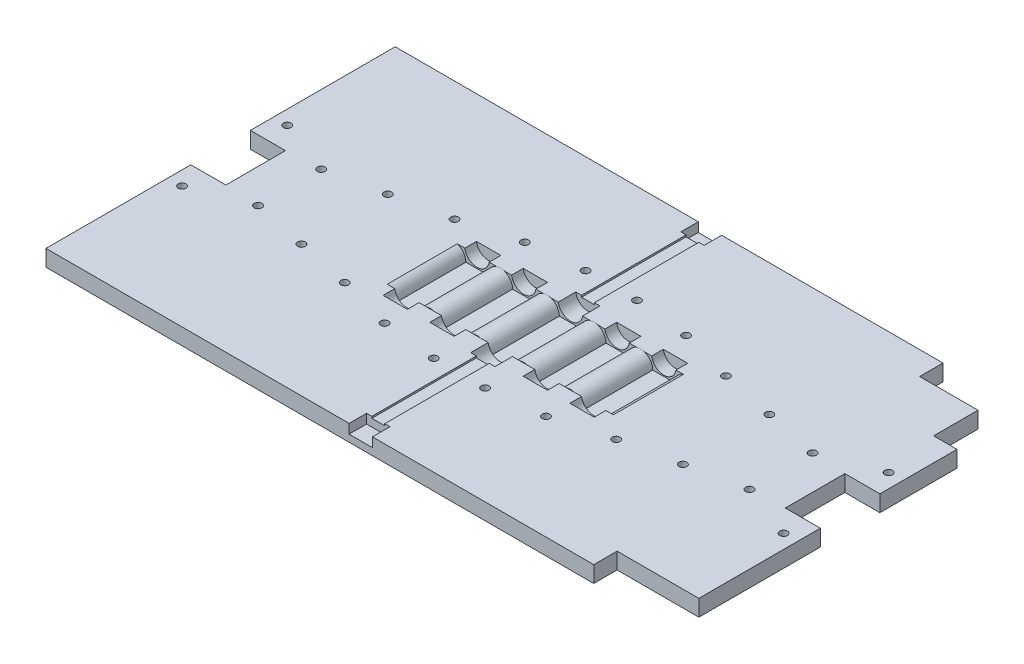
from build123d import *

# Parameters (mm, degrees)
SKETCH1_W               = 539
SKETCH1_H               = 299
BOSS_EXTRUDE1_DEPTH     = 14
SKETCH15_W              = 70
SKETCH15_H              = 20
CUT_EXTRUDE8_DEPTH      = 309.506888092
SKETCH2_W               = 30
SKETCH2_H               = 51
CUT_EXTRUDE1_DEPTH      = 309.506888092
SKETCH16_W              = 200
SKETCH16_H              = 60
CUT_EXTRUDE9_DEPTH      = 10
SKETCH17_R              = 10.5
CUT_EXTRUDE10_DEPTH     = 15
SKETCH18_R              = 10.5
CUT_EXTRUDE11_DEPTH     = 10
BOSS_EXTRUDE2_DEPTH     = 60
MIRROR4_COPY_1_SKETCH_R = 10.5
MIRROR4_COPY_1_DEPTH    = 10
M6_CLEARANCE_HOLE1_D    = 6.6
MIRROR7_COPY_1_D        = 6.6
SKETCH23_W              = 11
SKETCH23_H              = 104.5
CUT_EXTRUDE12_DEPTH     = 1.5
SKETCH24_W              = 20
SKETCH24_H              = 30
CUT_EXTRUDE13_DEPTH     = 8


with BuildPart() as part:
    # Sketch1 → Boss-Extrude1 (new body)
    with BuildSketch(Plane(origin=(0, 0, 0), x_dir=(1, 0, 0), z_dir=(0, 1, 0))):
        Rectangle(SKETCH1_W, SKETCH1_H)
    extrude(amount=-BOSS_EXTRUDE1_DEPTH)

    # Sketch15 → Cut-Extrude8 (cut, through all)
    with BuildSketch(Plane(origin=(0, 0, 0), x_dir=(1, 0, 0), z_dir=(0, 1, 0))):
        Polygon((269.5, 149.5), (199.5, 149.5), (199.5, 129.5), (249.5, 129.5), (249.5, 91.5), (269.5, 91.5), align=None)
        with Locations((234.5, -139.5)):
            Rectangle(SKETCH15_W, SKETCH15_H)
    extrude(amount=-CUT_EXTRUDE8_DEPTH, mode=Mode.SUBTRACT)

    # Sketch2 → Cut-Extrude1 (cut, through all)
    with BuildSketch(Plane(origin=(0, 0, 0), x_dir=(1, 0, 0), z_dir=(0, 1, 0))):
        with Locations((-254.5, 0)):
            Rectangle(SKETCH2_W, SKETCH2_H)
    cut_extrude1 = extrude(amount=-CUT_EXTRUDE1_DEPTH, mode=Mode.SUBTRACT)

    # Mirror1: Cut-Extrude1 across plane
    add(cut_extrude1.mirror(Plane(origin=(0, 0, 0), x_dir=(0, 0, 1), z_dir=(1, 0, 0))), mode=Mode.SUBTRACT)

    # Sketch16 → Cut-Extrude9 (cut)
    with BuildSketch(Plane(origin=(0, 0, 0), x_dir=(1, 0, 0), z_dir=(0, 1, 0))):
        Rectangle(SKETCH16_W, SKETCH16_H)
    extrude(amount=-CUT_EXTRUDE9_DEPTH, mode=Mode.SUBTRACT)

    # Sketch17 → Cut-Extrude10 (cut)
    with BuildSketch(Plane.XY.offset(-30)):
        with Locations((0, 1.5)):
            Circle(SKETCH17_R)
    cut_extrude10 = extrude(amount=-CUT_EXTRUDE10_DEPTH, mode=Mode.SUBTRACT)

    # Sketch18 → Cut-Extrude11 (cut)
    with BuildSketch(Plane.XY.offset(-30)):
        with Locations((-39.971865105, 1.5)):
            Circle(SKETCH18_R)
        with Locations((-79.971865105, 1.5)):
            Circle(SKETCH18_R)
    cut_extrude11 = extrude(amount=-CUT_EXTRUDE11_DEPTH, mode=Mode.SUBTRACT)

    # Sketch19 → Boss-Extrude2 (add)
    with BuildSketch(Plane.XY.offset(-30)):
        with BuildLine():
            Line((-9.5, -10), (-30.5, -10))
            ThreePointArc((-30.5, -10), (-20, 0.5), (-9.5, -10))
        make_face()
        with BuildLine():
            Line((-89.5, -10), (-100, -10))
            Line((-100, -10), (-100, 0))
            Line((-100, 0), (-96.798437881, 0))
            ThreePointArc((-96.798437881, 0), (-91.518655701, -3.809943548), (-89.5, -10))
        make_face()
        with BuildLine():
            Line((-49.5, -10), (-70.5, -10))
            ThreePointArc((-70.5, -10), (-60, 0.5), (-49.5, -10))
        make_face()
    boss_extrude2 = extrude(amount=BOSS_EXTRUDE2_DEPTH)

    # Mirror2: Boss-Extrude2 across plane
    add(boss_extrude2.mirror(Plane(origin=(0, 0, 0), x_dir=(0, 0, 1), z_dir=(1, 0, 0))))

    # Mirror3: Cut-Extrude11 across plane
    add(cut_extrude11.mirror(Plane(origin=(0, 0, 0), x_dir=(0, 0, 1), z_dir=(1, 0, 0))), mode=Mode.SUBTRACT)

    # Mirror4: Cut-Extrude10, Cut-Extrude11 across plane
    add(cut_extrude10.mirror(Plane.XY), mode=Mode.SUBTRACT)
    add(cut_extrude11.mirror(Plane.XY), mode=Mode.SUBTRACT)

    # Mirror4 copy 1 sketch → Mirror4 copy 1 (cut)
    with BuildSketch(Plane(origin=(0, 0, 30), x_dir=(-1, 0, 0), z_dir=(0, 0, -1))):
        with Locations((-39.971865105, 1.5)):
            Circle(MIRROR4_COPY_1_SKETCH_R)
        with Locations((-79.971865105, 1.5)):
            Circle(MIRROR4_COPY_1_SKETCH_R)
    extrude(amount=-MIRROR4_COPY_1_DEPTH, mode=Mode.SUBTRACT)

    # M6 Clearance Hole1 (through all)
    with Locations(Plane(origin=(-257.5, 0, 45), x_dir=(0, 0, 1), z_dir=(0, 1, 0))):
        with Locations((0, 0), (-18.019432511, 47.1), (-8.008018456, 94.2), (2.003395598, 141.3), (15, 188.4), (20, 235.5)):
            m6_clearance_hole1 = Hole(M6_CLEARANCE_HOLE1_D / 2)

    # Mirror6: M6 Clearance Hole1 across plane
    add(m6_clearance_hole1.mirror(Plane(origin=(0, 0, 0), x_dir=(0, 0, 1), z_dir=(1, 0, 0))), mode=Mode.SUBTRACT)

    # Mirror7: M6 Clearance Hole1 across plane
    add(m6_clearance_hole1.mirror(Plane.XY), mode=Mode.SUBTRACT)

    # Mirror7 copy 1 (through all)
    with Locations(Plane(origin=(257.5, 0, -45), x_dir=(0, 0, -1), z_dir=(0, 1, 0))):
        with Locations((0, 0), (-18.019432511, 47.1), (-8.008018456, 94.2), (2.003395598, 141.3), (15, 188.4), (20, 235.5)):
            Hole(MIRROR7_COPY_1_D / 2)

    # Sketch23 → Cut-Extrude12 (cut)
    with BuildSketch(Plane(origin=(0, 0, 0), x_dir=(1, 0, 0), z_dir=(0, 1, 0))):
        with Locations((0, 97.25)):
            Rectangle(SKETCH23_W, SKETCH23_H)
    cut_extrude12 = extrude(amount=-CUT_EXTRUDE12_DEPTH, mode=Mode.SUBTRACT)

    # Sketch24 → Cut-Extrude13 (cut)
    with BuildSketch(Plane(origin=(0, 0, 0), x_dir=(1, 0, 0), z_dir=(0, 1, 0))):
        with Locations((0, 149.5)):
            Rectangle(SKETCH24_W, SKETCH24_H)
    cut_extrude13 = extrude(amount=-CUT_EXTRUDE13_DEPTH, mode=Mode.SUBTRACT)

    # Mirror8: Cut-Extrude12, Cut-Extrude13 across plane
    add(cut_extrude12.mirror(Plane.XY), mode=Mode.SUBTRACT)
    add(cut_extrude13.mirror(Plane.XY), mode=Mode.SUBTRACT)


solid = part.part
